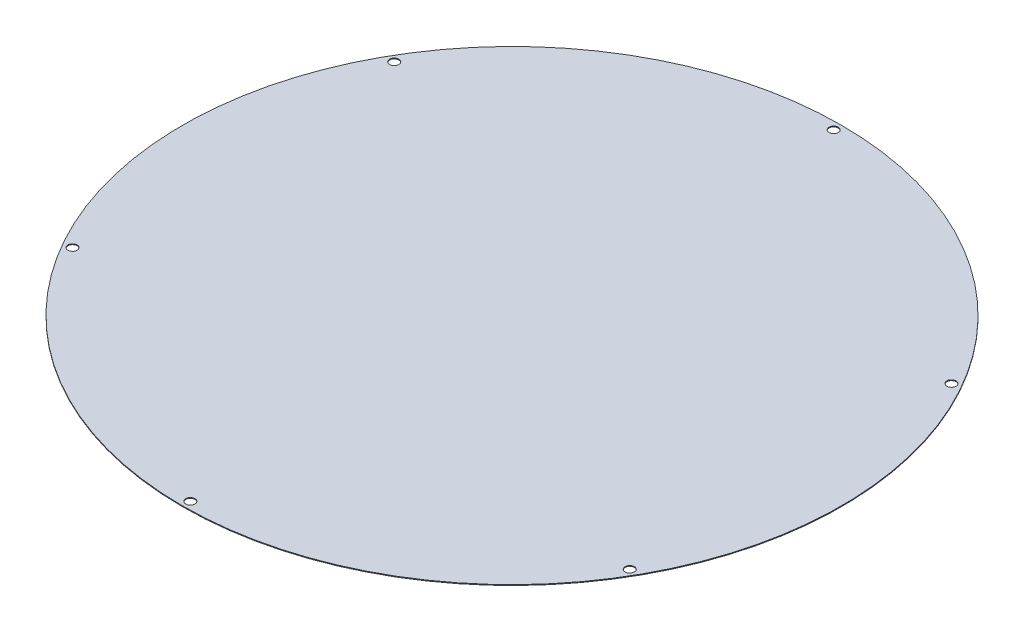
from build123d import *

# Parameters (mm, degrees)
SKETCH1_R           = 105
SKETCH1_R_2         = 1.4732
SKETCH1_R_3         = 100
BOSS_EXTRUDE1_DEPTH = 0.254


with BuildPart() as part:
    # Sketch1 → Boss-Extrude1 (new body)
    # profile 1 of 2: a face of its own
    with BuildSketch(Plane(origin=(0, 0, 0), x_dir=(1, 0, 0), z_dir=(0, 1, 0))):
        with Locations(Location((0, 0, 0), (0, 0, 270))):
            Circle(SKETCH1_R)
        with Locations(Location((88.768103888, -51.250866025, 0), (0, 0, 270))):
            Circle(SKETCH1_R_2, mode=Mode.SUBTRACT)
        with Locations(Location((88.769103888, 51.249133975, 0), (0, 0, 270))):
            Circle(SKETCH1_R_2, mode=Mode.SUBTRACT)
        with Locations(Location((0.002, 102.5, 0), (0, 0, 270))):
            Circle(SKETCH1_R_2, mode=Mode.SUBTRACT)
        with Locations(Location((-88.766103888, 51.250866025, 0), (0, 0, 270))):
            Circle(SKETCH1_R_2, mode=Mode.SUBTRACT)
        with Locations(Location((-88.767103888, -51.249133975, 0), (0, 0, 270))):
            Circle(SKETCH1_R_2, mode=Mode.SUBTRACT)
        with Locations(Location((0, -102.5, 0), (0, 0, 270))):
            Circle(SKETCH1_R_2, mode=Mode.SUBTRACT)
        Circle(SKETCH1_R_3, mode=Mode.SUBTRACT)
    # profile 2 of 2: a face of its own
    with BuildSketch(Plane(origin=(0, 0, 0), x_dir=(1, 0, 0), z_dir=(0, 1, 0))):
        Circle(SKETCH1_R_3)
    extrude(amount=BOSS_EXTRUDE1_DEPTH)


solid = part.part
